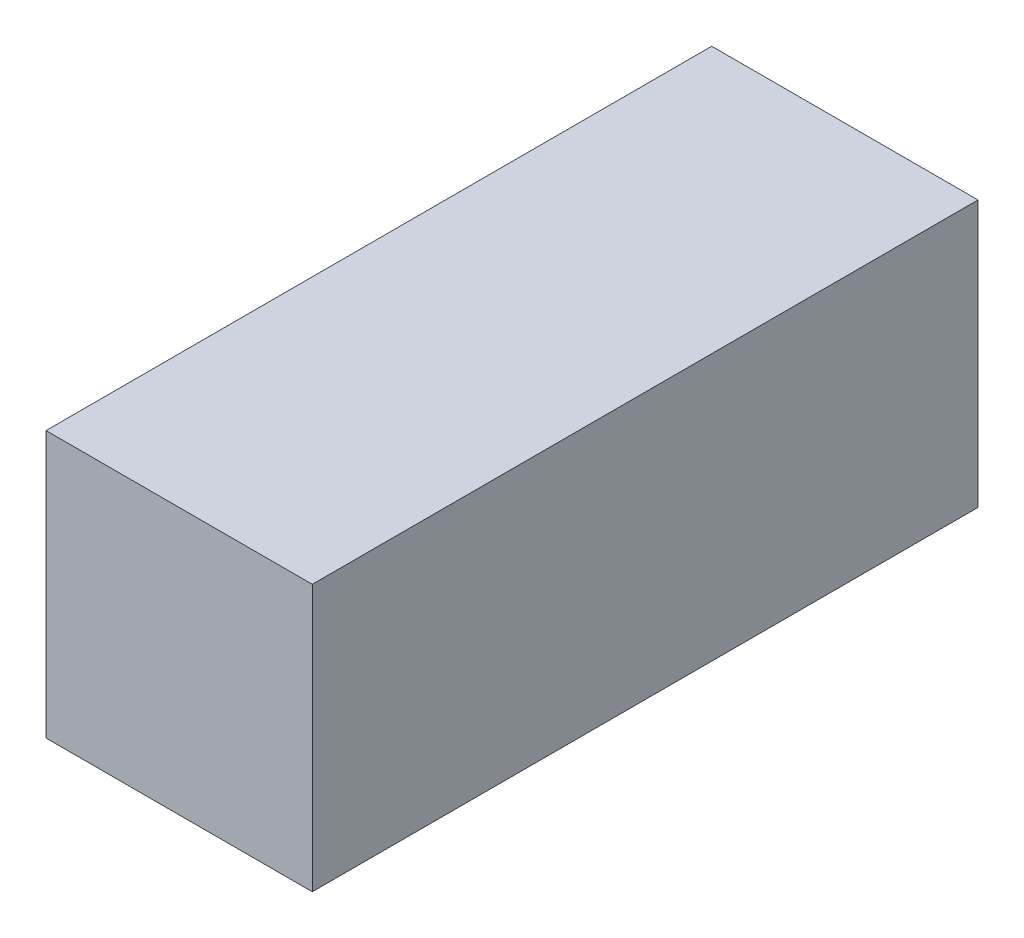
from build123d import *

# Parameters (mm, degrees)
SKETCH1_W           = 50.8
SKETCH1_H           = 50.8
BOSS_EXTRUDE1_DEPTH = 127


with BuildPart() as part:
    # Sketch1 → Boss-Extrude1 (new body)
    with BuildSketch(Plane.XY):
        Rectangle(SKETCH1_W, SKETCH1_H)
    extrude(amount=BOSS_EXTRUDE1_DEPTH)


solid = part.part
